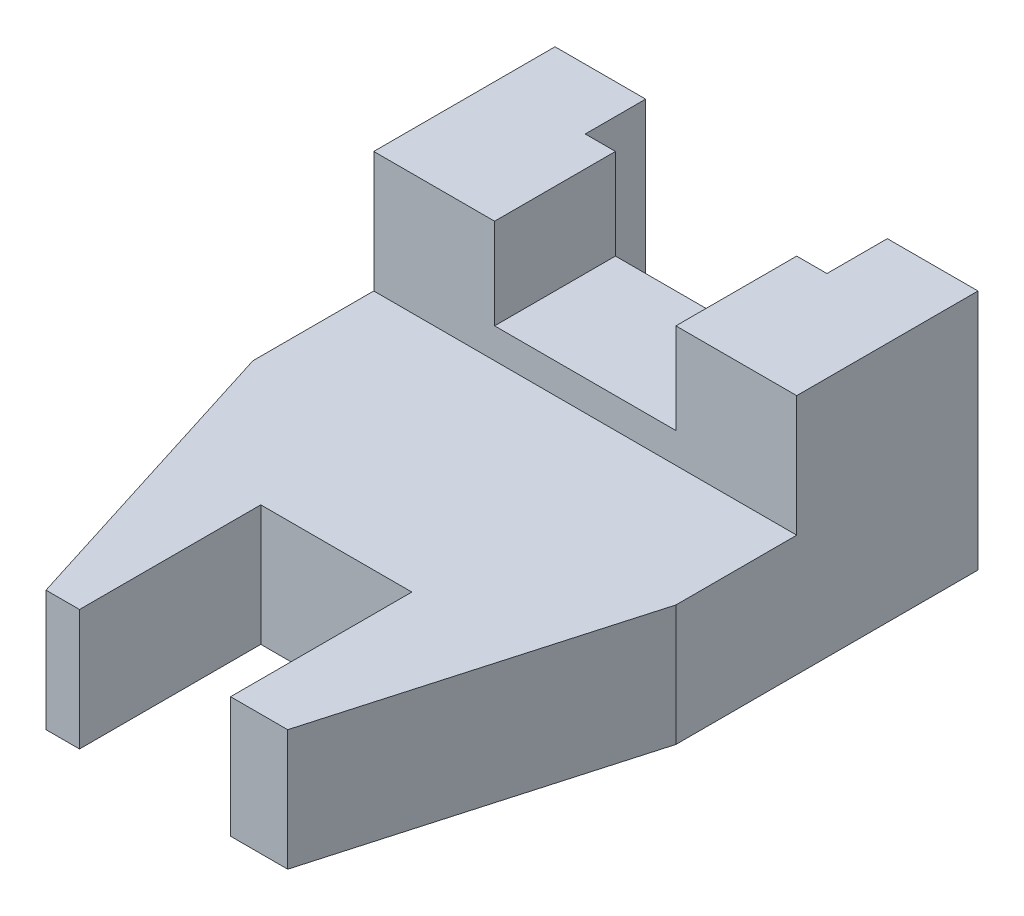
from build123d import *

# Parameters (mm, degrees)
BOSS_EXTRUDE1_DEPTH      = 20
BOSS_EXTRUDE7_DEPTH      = 20
BOSS_EXTRUDE7_DEPTH_BACK = 20
SKETCH5_W                = 30
SKETCH5_H                = 20
BOSS_EXTRUDE12_DEPTH     = 20
SKETCH6_W                = 30
SKETCH6_H                = 20
BOSS_EXTRUDE13_DEPTH     = 5


with BuildPart() as part:
    # Sketch1 → Boss-Extrude1 (new body)
    with BuildSketch(Plane(origin=(0, 0, 0), x_dir=(1, 0, 0), z_dir=(0, 1, 0))):
        Polygon((0, 0), (5.545454545, 0), (5.545454545, 30), (30.545454545, 30), (30.545454545, 0), (40, 0), (54.242424242, 50), (54.242424242, 100), (39.242424242, 100), (39.242424242, 90), (34.242424242, 90), (34.242424242, 70), (4.242424242, 70), (4.242424242, 90), (-0.757575758, 90), (-0.757575758, 100), (-15.757575758, 100), (-15.757575758, 50), align=None)
    extrude(amount=BOSS_EXTRUDE1_DEPTH)

    # Sketch2 → Boss-Extrude7 (add, two sides: drawn at the far end of the back side and taken through both)
    with BuildSketch(Plane(origin=(0, 20, 0), x_dir=(1, 0, 0), z_dir=(0, 1, 0)).offset(-BOSS_EXTRUDE7_DEPTH_BACK)):
        Polygon((-15.757575758, 100), (-0.757575758, 100), (-0.757575758, 90), (4.242424242, 90), (4.242424242, 70), (-15.757575758, 70), align=None)
        Polygon((54.242424242, 100), (39.242424242, 100), (39.242424242, 90), (34.242424242, 90), (34.242424242, 70), (54.242424242, 70), align=None)
    extrude(amount=BOSS_EXTRUDE7_DEPTH + BOSS_EXTRUDE7_DEPTH_BACK)

    # Sketch5 → Boss-Extrude12 (add)
    with BuildSketch(Plane(origin=(0, 20, 0), x_dir=(1, 0, 0), z_dir=(0, 1, 0))):
        with Locations((19.242424242, 80)):
            Rectangle(SKETCH5_W, SKETCH5_H)
    extrude(amount=-BOSS_EXTRUDE12_DEPTH)

    # Sketch6 → Boss-Extrude13 (add)
    with BuildSketch(Plane(origin=(0, 20, 0), x_dir=(1, 0, 0), z_dir=(0, 1, 0))):
        with Locations((19.242424242, 80)):
            Rectangle(SKETCH6_W, SKETCH6_H)
    extrude(amount=BOSS_EXTRUDE13_DEPTH)


solid = part.part
